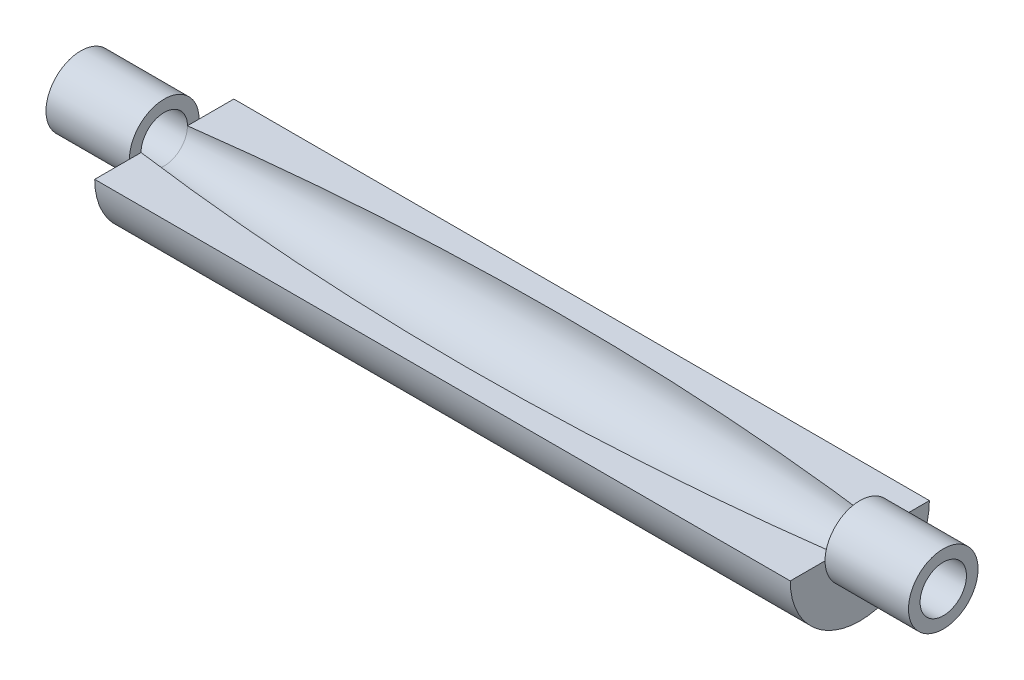
from build123d import *
from build123d.topology import SkipClean

# Parameters (mm, degrees)
REVOLVE2_ANGLE = 180.0000000000004


with BuildPart() as part:
    # Sketch2 → Revolve2 (revolve)
    with BuildSketch(Plane(origin=(0, 0, 0), x_dir=(1, 0, 0), z_dir=(0, 1, 0))):
        with BuildLine():
            Line((-186, -15.000000000000009), (-150, -15))
            Line((-150, -15), (-150, -30.000000000000004))
            Line((-150, -30.000000000000004), (150, -29.999999999999947))
            Line((150, -29.999999999999947), (150, -15))
            Line((150, -15), (186, -15.000000000000009))
            Line((186, -15.000000000000009), (186, -10.000000000000014))
            Line((186, -10.000000000000014), (150, -10.000000000000005))
            ThreePointArc((150, -10.000000000000005), (-1.3897e-13, -20), (-150, -10.000000000000005))
            Line((-150, -10.000000000000005), (-186, -10.000000000000014))
            Line((-186, -10.000000000000014), (-186, -15.000000000000009))
        make_face()
    revolve(axis=Axis((-186, 0, 0), (1, 0, 0)), revolution_arc=REVOLVE2_ANGLE)

    # Sketch3 → Revolve3 (revolve)
    with BuildSketch(Plane.XY, mode=Mode.PRIVATE) as revolve3_sk:
        Polygon((-186, 9.999999999999988), (-186, 14.99999999999999), (-150, 14.999999999999988), (-150, 9.999999999999993), align=None)
    revolve3 = revolve(revolve3_sk.sketch.rotate(Axis((-186, 0, 0), (1, 0, 0)), 90), axis=Axis((-186, 0, 0), (1, 0, 0)))

    # Mirror1: Revolve3 across plane
    with SkipClean():  # the faces are left unmerged after this step: merging them gives an invalid solid
        add(revolve3.mirror(Plane(origin=(0, 0, 0), x_dir=(0, 0, 1), z_dir=(1, 0, 0))))


solid = part.part
